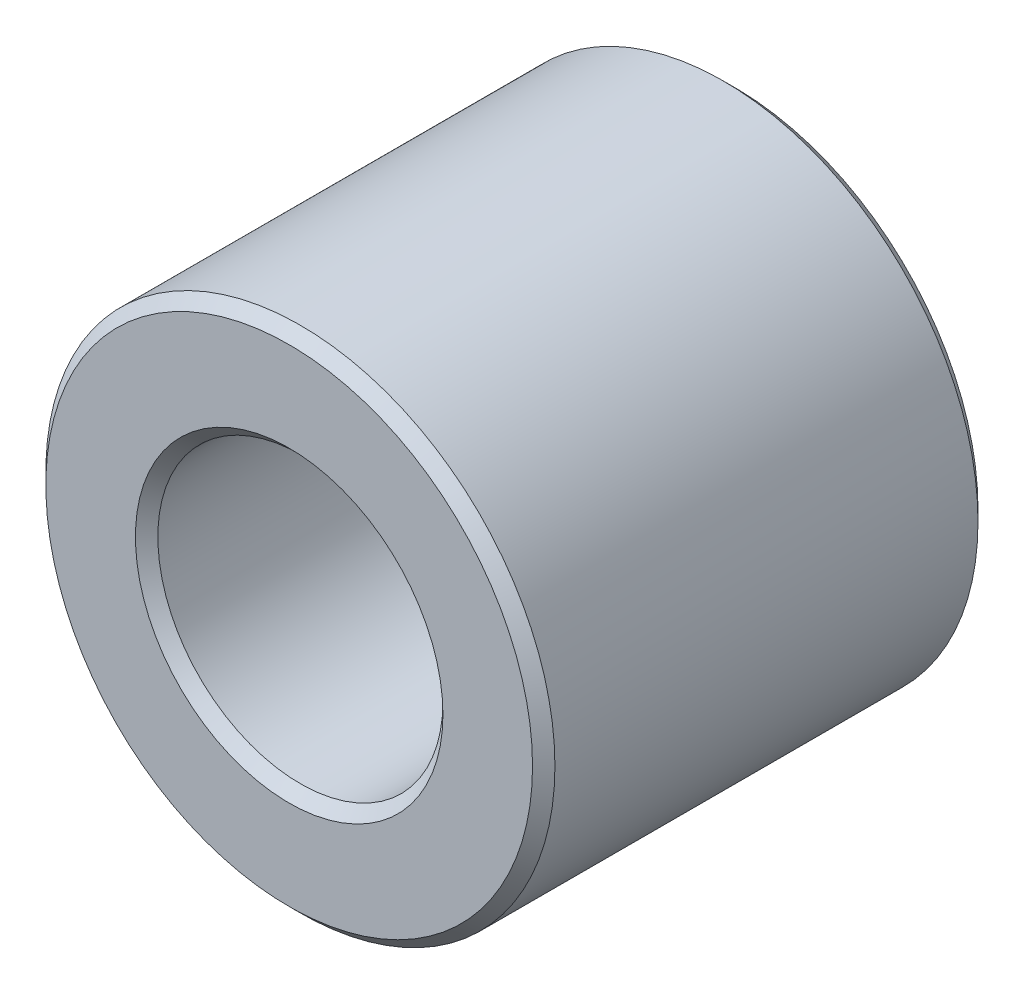
from build123d import *

# Parameters (mm, degrees)
BOSS_EXTRUDE1_DEPTH      = 2.778125
BOSS_EXTRUDE1_DEPTH_BACK = 2.778125
SKETCH3_R                = 3.175
SKETCH3_R_2              = 1.778
CHAMFER1_SIZE            = 0.1397


with BuildPart() as part:
    # Sketch3 → Boss-Extrude1 (new, two sides: drawn at the far end of the back side and taken through both)
    with BuildSketch(Plane.XY.offset(-BOSS_EXTRUDE1_DEPTH_BACK)):
        Circle(SKETCH3_R)
        Circle(SKETCH3_R_2, mode=Mode.SUBTRACT)
    extrude(amount=BOSS_EXTRUDE1_DEPTH + BOSS_EXTRUDE1_DEPTH_BACK)

    # Chamfer1
    chamfer1_edges = [part.edges().sort_by_distance(p)[0] for p in [
        (-3.175, 0, -2.778125),
        (-1.778, 0, -2.778125),
        (-3.175, 0, 2.778125),
        (-1.778, 0, 2.778125),
    ]]
    chamfer(chamfer1_edges, length=CHAMFER1_SIZE)


solid = part.part
